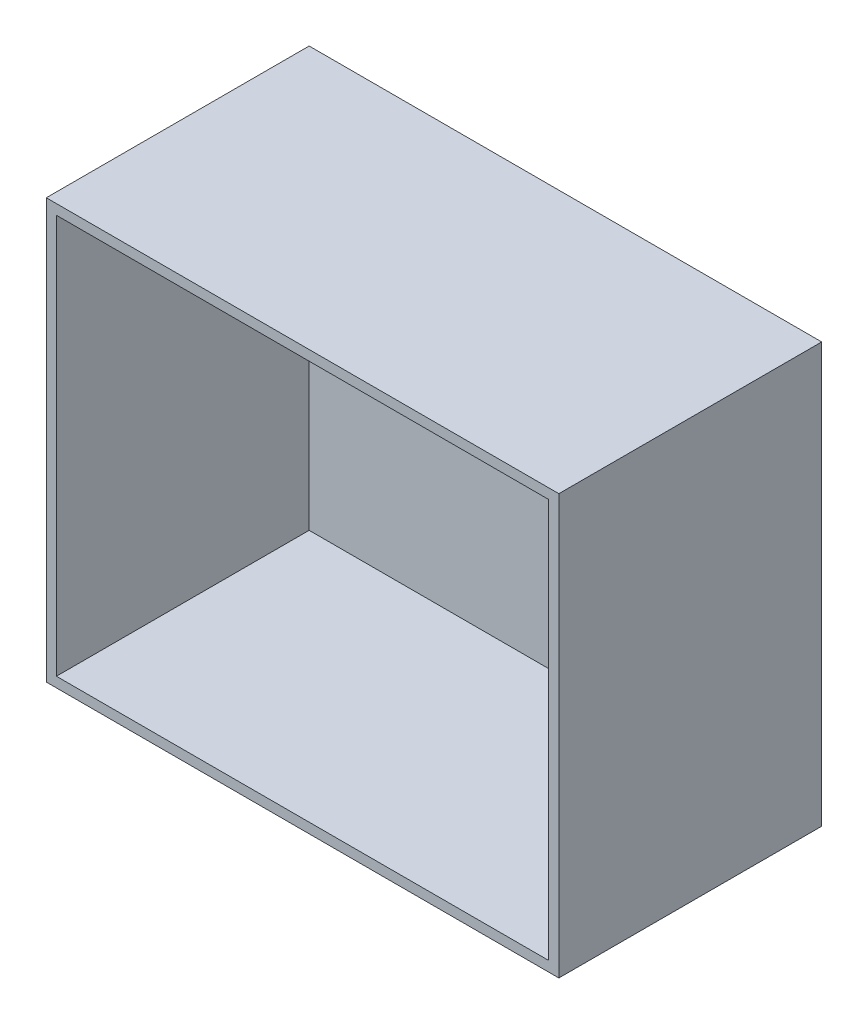
from build123d import *

# Parameters (mm, degrees)
SHEET_EXTRUDE_1_2_DEPTH = 50
SKETCH_1_2_W            = 97.399040294
SKETCH_1_2_H            = 78.98176722
THICKEN_1_T1            = 2


with BuildPart() as body_1:
    # Sheet Extrude 1: a surface, the sketch's curves swept straight by 50 mm
    with BuildLine(Plane.XY, mode=Mode.PRIVATE) as sheet_extrude_1_2_path:
        Line((-42.324310237, 40.376329431), (55.074730057, 40.376329431))
        Line((55.074730057, 40.376329431), (55.074730057, -38.605437789))
        Line((55.074730057, -38.605437789), (-42.324310237, -38.605437789))
        Line((-42.324310237, -38.605437789), (-42.324310237, 40.376329431))
    sheet_extrude_1_2 = Shell.extrude(sheet_extrude_1_2_path.wire(), (0 * SHEET_EXTRUDE_1_2_DEPTH, 0 * SHEET_EXTRUDE_1_2_DEPTH, 1 * SHEET_EXTRUDE_1_2_DEPTH))
    # Эскиз1<2> → Sheet Fill 1: a flat surface bounded by the sketch
    with BuildSketch(Plane.XY, mode=Mode.PRIVATE) as sheet_fill_1_3_region:
        with Locations((6.37520991, 0.885445821)):
            Rectangle(SKETCH_1_2_W, SKETCH_1_2_H)
    sheet_fill_1_3 = sheet_fill_1_3_region.sketch.faces()[0]
    # Knit 1: the surfaces knitted into one
    knit_1_1 = Shell(Face.sew_faces(sheet_extrude_1_2.faces() + sheet_fill_1_3.faces())[0])
    add(Solid.thicken(knit_1_1, THICKEN_1_T1))


solid = body_1.part
